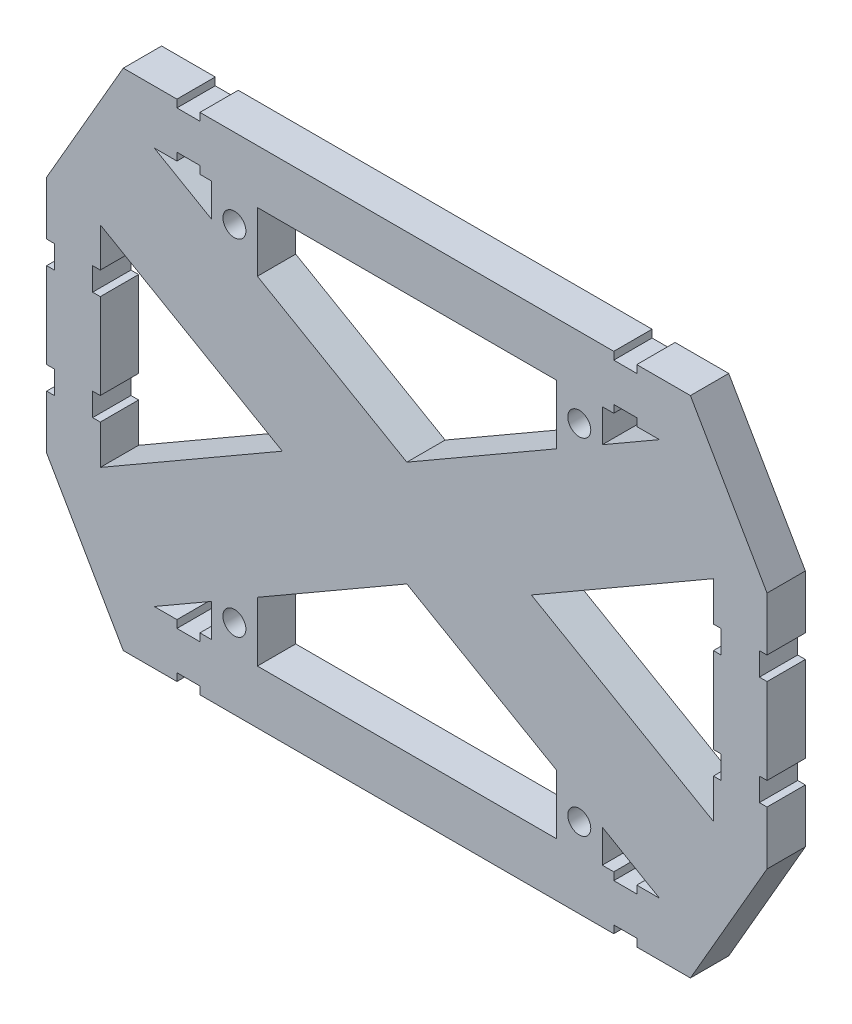
from build123d import *

# Parameters (mm, degrees)
ESQUISSE1_R             = 1.5
BOSS_EXTRU_2_DEPTH      = 5
ENL_V_MAT_EXTRU_2_DEPTH = 2


with BuildPart() as part:
    # Esquisse1 → Boss.-Extru.2 (new body)
    with BuildSketch(Plane.XY):
        Polygon((22, -30.022213998), (-32, -30.022213998), (-32, -29.022213998), (-35, -29.022213998), (-35, -30.022213998), (-42, -30.022213998), (-52, -12.701705922), (-52, -5.701705922), (-51, -5.701705922), (-51, -2.701705922), (-52, -2.701705922), (-52, 8.475208614), (-51, 8.475208614), (-51, 11.475208614), (-52, 11.475208614), (-52, 18.475208614), (-42, 35.79571669), (-35, 35.79571669), (-35, 34.79571669), (-32, 34.79571669), (-32, 35.79571669), (22, 35.79571669), (22, 34.79571669), (25, 34.79571669), (25, 35.79571669), (32, 35.79571669), (42, 18.475208614), (42, 11.475208614), (41, 11.475208614), (41, 8.475208614), (42, 8.475208614), (42, -2.701705922), (41, -2.701705922), (41, -5.701705922), (42, -5.701705922), (42, -12.701705922), (32, -30.022213998), (25, -30.022213998), (25, -29.022213998), (22, -29.022213998), align=None)
        with Locations((17.5, 25.386751346)):
            Circle(ESQUISSE1_R, mode=Mode.SUBTRACT)
        with Locations((-27.5, 25.386751346)):
            Circle(ESQUISSE1_R, mode=Mode.SUBTRACT)
        with Locations((17.5, -19.613248654)):
            Circle(ESQUISSE1_R, mode=Mode.SUBTRACT)
        with Locations((-27.5, -19.613248654)):
            Circle(ESQUISSE1_R, mode=Mode.SUBTRACT)
        Polygon((-45, 8.475208614), (-45, -2.701705922), (-46, -2.701705922), (-46, -5.701705922), (-45, -5.701705922), (-45, -10.826061575), (-21.248711306, 2.886751346), (-45, 16.599564267), (-45, 11.475208614), (-46, 11.475208614), (-46, 8.475208614), align=None, mode=Mode.SUBTRACT)
        Polygon((35, 16.599564267), (11.248711306, 2.886751346), (35, -10.826061575), (35, -5.701705922), (36, -5.701705922), (36, -2.701705922), (35, -2.701705922), (35, 8.475208614), (36, 8.475208614), (36, 11.475208614), (35, 11.475208614), align=None, mode=Mode.SUBTRACT)
        Polygon((-37.958548116, -23.022213998), (-35, -23.022213998), (-35, -24.022213998), (-32, -24.022213998), (-32, -23.022213998), (-30.5, -23.022213998), (-30.5, -18.716019236), align=None, mode=Mode.SUBTRACT)
        Polygon((14.5, -23.022213998), (-5, -23.022213998), (-24.5, -23.022213998), (-24.5, -15.25191762), (-5, -3.993587371), (14.5, -15.25191762), align=None, mode=Mode.SUBTRACT)
        Polygon((-32, 29.79571669), (-32, 28.79571669), (-30.5, 28.79571669), (-30.5, 24.489521927), (-37.958548116, 28.79571669), (-35, 28.79571669), (-35, 29.79571669), align=None, mode=Mode.SUBTRACT)
        Polygon((27.958548116, 28.79571669), (20.5, 24.489521927), (20.5, 28.79571669), (22, 28.79571669), (22, 29.79571669), (25, 29.79571669), (25, 28.79571669), align=None, mode=Mode.SUBTRACT)
        Polygon((22, -24.022213998), (22, -23.022213998), (20.5, -23.022213998), (20.5, -18.716019236), (27.958548116, -23.022213998), (25, -23.022213998), (25, -24.022213998), align=None, mode=Mode.SUBTRACT)
        Polygon((-24.5, 28.79571669), (-24.5, 21.025420312), (-5, 9.767090063), (14.5, 21.025420312), (14.5, 28.79571669), (-5, 28.79571669), align=None, mode=Mode.SUBTRACT)
    extrude(amount=BOSS_EXTRU_2_DEPTH)

    # Esquisse4 → Enlèv. mat.-Extru.2 (cut)
    with BuildSketch(Plane(origin=(0, 0, 0), x_dir=(-1, 0, 0), z_dir=(0, 0, -1))):
        Polygon((-17.5, 23.029642358), (-15.458683737, 24.208196852), (-15.458683737, 26.56530584), (-17.5, 27.743860334), (-19.541316263, 26.56530584), (-19.541316263, 24.208196852), align=None)
        Polygon((29.541316263, 24.208196852), (27.5, 23.029642358), (25.458683737, 24.208196852), (25.458683737, 26.56530584), (27.5, 27.743860334), (29.541316263, 26.56530584), align=None)
        Polygon((27.5, -17.256139666), (25.458683737, -18.43469416), (25.458683737, -20.791803148), (27.5, -21.970357642), (29.541316263, -20.791803148), (29.541316263, -18.43469416), align=None)
        Polygon((-19.541316263, -18.43469416), (-17.5, -17.256139666), (-15.458683737, -18.43469416), (-15.458683737, -20.791803148), (-17.5, -21.970357642), (-19.541316263, -20.791803148), align=None)
    extrude(amount=-ENL_V_MAT_EXTRU_2_DEPTH, mode=Mode.SUBTRACT)


solid = part.part
